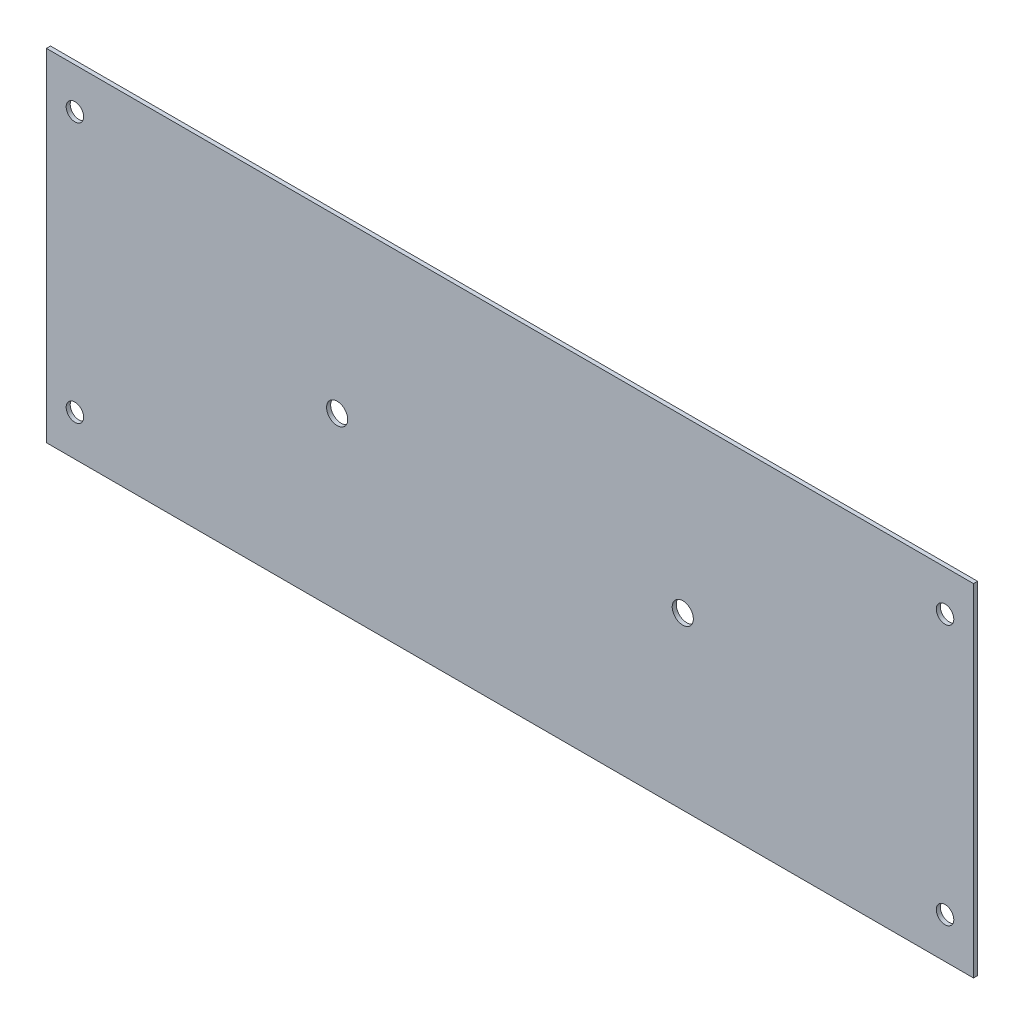
from build123d import *

# Parameters (mm, degrees)
SKETCH_1_W      = 228
SKETCH_1_H      = 84
SKETCH_1_R      = 2.6
SKETCH_1_R_2    = 2.15
EXTRUDE_1_DEPTH = 1


with BuildPart() as part:
    # Эскиз1 → Вытянуть1 (new body)
    with BuildSketch(Plane.XY):
        Rectangle(SKETCH_1_W, SKETCH_1_H)
        with Locations((-42.5, 0)):
            Circle(SKETCH_1_R, mode=Mode.SUBTRACT)
        with Locations((42.5, 0)):
            Circle(SKETCH_1_R, mode=Mode.SUBTRACT)
        with Locations((107, 32)):
            Circle(SKETCH_1_R_2, mode=Mode.SUBTRACT)
        with Locations(Location((-107, 32, 0), (0, 0, 180))):
            Circle(SKETCH_1_R_2, mode=Mode.SUBTRACT)
        with Locations((-107, -32)):
            Circle(SKETCH_1_R_2, mode=Mode.SUBTRACT)
        with Locations(Location((107, -32, 0), (0, 0, 180))):
            Circle(SKETCH_1_R_2, mode=Mode.SUBTRACT)
    extrude(amount=EXTRUDE_1_DEPTH)


solid = part.part
